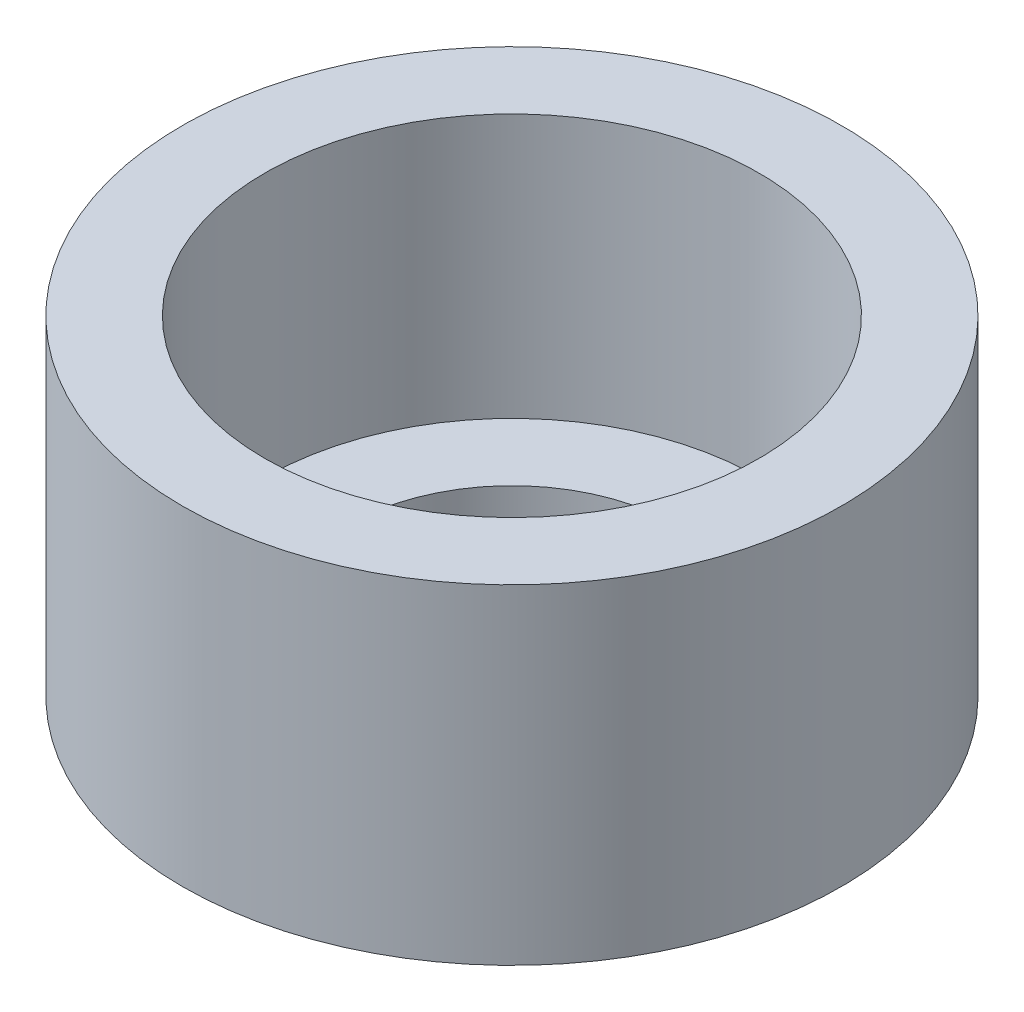
from build123d import *

# Parameters (mm, degrees)
SKETCH2_R           = 10
SKETCH2_R_2         = 5
BOSS_EXTRUDE1_DEPTH = 10
SKETCH3_R           = 7.5
CUT_EXTRUDE1_DEPTH  = 8


with BuildPart() as part:
    # Sketch2 → Boss-Extrude1 (new body)
    with BuildSketch(Plane(origin=(0, 0, 0), x_dir=(1, 0, 0), z_dir=(0, 1, 0))):
        with Locations(Location((0, 0, 0), (0, 0, 270))):
            Circle(SKETCH2_R)
        with Locations(Location((0, 0, 0), (0, 0, 270))):
            Circle(SKETCH2_R_2, mode=Mode.SUBTRACT)
    extrude(amount=BOSS_EXTRUDE1_DEPTH)

    # Sketch3 → Cut-Extrude1 (cut)
    with BuildSketch(Plane(origin=(0, 10, 0), x_dir=(1, 0, 0), z_dir=(0, 1, 0))):
        with Locations(Location((0, 0, 0), (0, 0, 270))):
            Circle(SKETCH3_R)
    extrude(amount=-CUT_EXTRUDE1_DEPTH, mode=Mode.SUBTRACT)


solid = part.part
